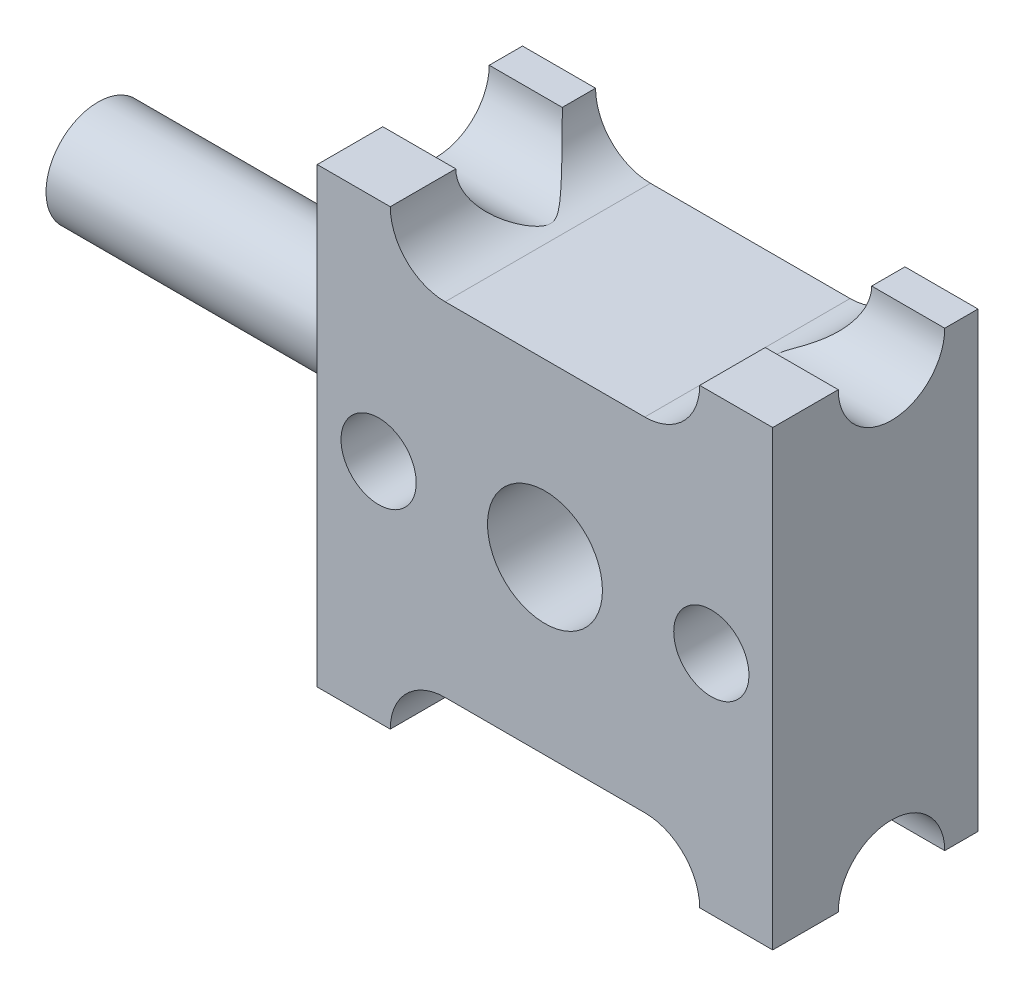
from build123d import *

# Parameters (mm, degrees)
SKETCH1_W           = 13.6906
SKETCH1_H           = 13.6
BOSS_EXTRUDE1_DEPTH = 6.17
SKETCH2_R           = 1.6
CUT_EXTRUDE1_DEPTH  = 17.484581534
SKETCH3_W           = 6
SKETCH3_H           = 1.65
CUT_EXTRUDE2_DEPTH  = 12.452817649
SKETCH4_R           = 1.7272
CUT_EXTRUDE3_DEPTH  = 12.452817822
SKETCH5_R           = 1.5621
BOSS_EXTRUDE2_DEPTH = 10.16
SKETCH6_R           = 1.1303
CUT_EXTRUDE4_DEPTH  = 20.325866881


with BuildPart() as part:
    # Sketch1 → Boss-Extrude1 (new body)
    with BuildSketch(Plane.XY):
        Rectangle(SKETCH1_W, SKETCH1_H)
    extrude(amount=BOSS_EXTRUDE1_DEPTH)

    # Sketch2 → Cut-Extrude1 (cut, through all)
    with BuildSketch(Plane(origin=(6.8453, 0, 0), x_dir=(0, 0, -1), z_dir=(1, 0, 0))):
        with Locations((-2.6, 6.8)):
            Circle(SKETCH2_R)
        with Locations((-2.6, -6.8)):
            Circle(SKETCH2_R)
    extrude(amount=-CUT_EXTRUDE1_DEPTH, mode=Mode.SUBTRACT)

    # Sketch3 → Cut-Extrude2 (cut, through all)
    with BuildSketch(Plane.XY.offset(6.17)):
        with BuildLine():
            Line((-3, 5.15), (-3, 6.8))
            Line((-3, 6.8), (-4.65, 6.8))
            ThreePointArc((-4.65, 6.8), (-4.166726189, 5.633273811), (-3, 5.15))
        make_face()
        with Locations((0, 5.975)):
            Rectangle(SKETCH3_W, SKETCH3_H)
        with BuildLine():
            Line((4.65, 6.8), (3, 6.8))
            Line((3, 6.8), (3, 5.15))
            ThreePointArc((3, 5.15), (4.166726189, 5.633273811), (4.65, 6.8))
        make_face()
        with BuildLine():
            Line((3, -5.15), (3, -6.8))
            Line((3, -6.8), (4.65, -6.8))
            ThreePointArc((4.65, -6.8), (4.166726189, -5.633273811), (3, -5.15))
        make_face()
        with Locations((0, -5.975)):
            Rectangle(SKETCH3_W, SKETCH3_H)
        with BuildLine():
            Line((-4.65, -6.8), (-3, -6.8))
            Line((-3, -6.8), (-3, -5.15))
            ThreePointArc((-3, -5.15), (-4.166726189, -5.633273811), (-4.65, -6.8))
        make_face()
    extrude(amount=-CUT_EXTRUDE2_DEPTH, mode=Mode.SUBTRACT)

    # Sketch4 → Cut-Extrude3 (cut, through all)
    with BuildSketch(Plane.XY.offset(6.17)):
        Circle(SKETCH4_R)
    extrude(amount=-CUT_EXTRUDE3_DEPTH, mode=Mode.SUBTRACT)

    # Sketch5 → Boss-Extrude2 (add)
    with BuildSketch(Plane.ZY.offset(6.8453)):
        with Locations(Location((2.6, 0, 0), (0, 0, 90))):
            Circle(SKETCH5_R)
    extrude(amount=BOSS_EXTRUDE2_DEPTH)

    # Sketch6 → Cut-Extrude4 (cut, through all)
    with BuildSketch(Plane.XY.offset(6.17)):
        with Locations((-5, 0)):
            Circle(SKETCH6_R)
        with Locations(Location((5, 0, 0), (0, 0, 180))):
            Circle(SKETCH6_R)
    extrude(amount=-CUT_EXTRUDE4_DEPTH, mode=Mode.SUBTRACT)


solid = part.part
